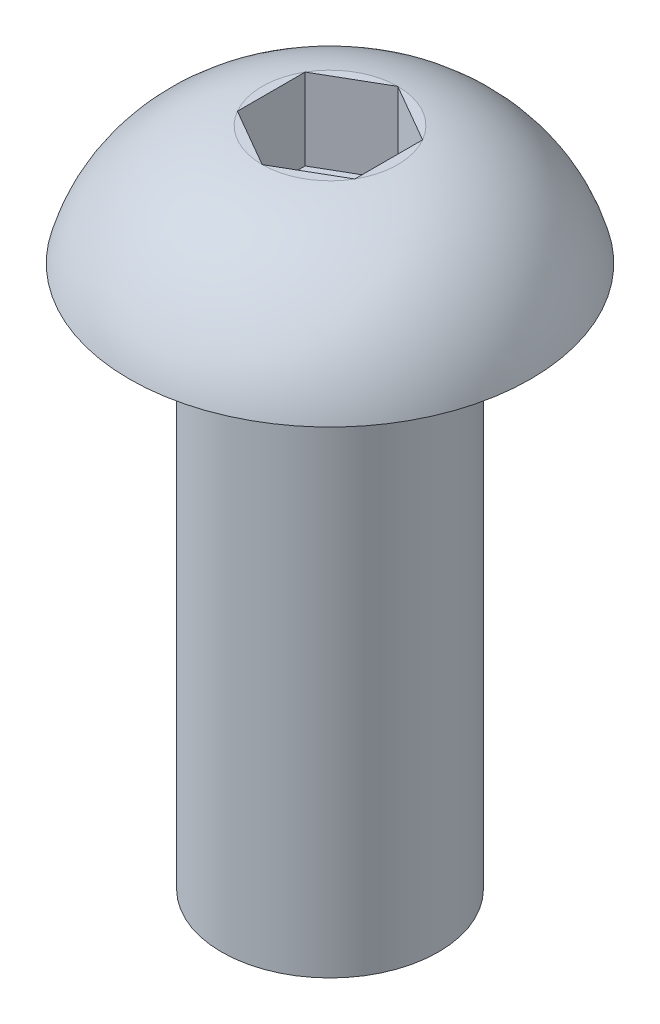
from build123d import *

# Parameters (mm, degrees)
SKETCH2_R           = 2
BOSS_EXTRUDE1_DEPTH = 10
CUT_EXTRUDE1_DEPTH  = 1.5


with BuildPart() as part:
    # Sketch1 → Revolve1 (revolve)
    with BuildSketch(Plane(origin=(0, 0, 0), x_dir=(0, 0, -1), z_dir=(1, 0, 0))):
        with BuildLine():
            Line((0, 0), (0, 2.2))
            Line((0, 2.2), (-1.25, 2.2))
            ThreePointArc((-1.25, 2.2), (-2.80380946, 1.466174172), (-3.7, 0))
            Line((-3.7, 0), (0, 0))
        make_face()
    revolve(axis=Axis((0, 4.725289413, 0), (0, -1, 0)))

    # Sketch2 → Boss-Extrude1 (add)
    with BuildSketch(Plane.XZ):
        with Locations(Location((0, 0, 0), (0, 0, 270))):
            Circle(SKETCH2_R)
    extrude(amount=BOSS_EXTRUDE1_DEPTH)

    # Sketch3 → Cut-Extrude1 (cut)
    with BuildSketch(Plane(origin=(0, 2.2, 0), x_dir=(1, 0, 0), z_dir=(0, 1, 0))):
        Polygon((0, 1.25), (-1.082531755, 0.625), (-1.082531755, -0.625), (0, -1.25), (1.082531755, -0.625), (1.082531755, 0.625), align=None)
    extrude(amount=-CUT_EXTRUDE1_DEPTH, mode=Mode.SUBTRACT)


solid = part.part
